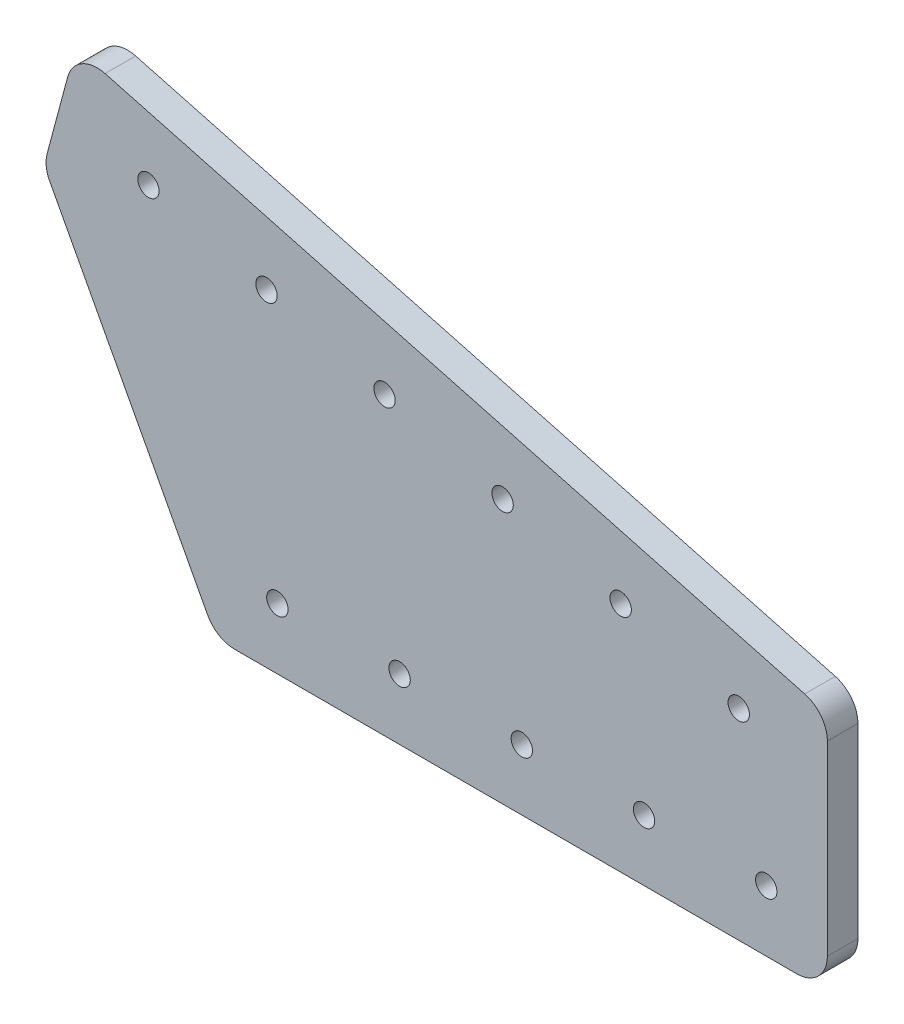
from build123d import *

# Parameters (mm, degrees)
BOSS_EXTRU_1_DEPTH           = 10
CONG_1_R                     = 10
ENL_V_MAT_EXTRU_1_DEPTH      = 246.669614874
ENL_V_MAT_EXTRU_1_DEPTH_BACK = 246.669614874
ESQUISSE2_R                  = 3.5


with BuildPart() as part:
    # Esquisse1 → Boss.-Extru.1 (new body)
    with BuildSketch(Plane.XY):
        Polygon((0, 0), (-56.389768432, 105.925417234), (-46.037006628, 144.562450286), (200, 78.637033052), (200, 0), align=None)
    extrude(amount=BOSS_EXTRU_1_DEPTH)

    # Congé1
    cong_1_edges = [part.edges().sort_by_distance(p)[0] for p in [
        (0, 0, 5),
        (-56.389768432, 105.925417234, 5),
        (-46.037006628, 144.562450286, 5),
        (200, 78.637033052, 5),
        (200, 0, 5),
    ]]
    fillet(cong_1_edges, radius=CONG_1_R)

    # Esquisse2 → Enlèv. mat.-Extru.1 (cut, two sides: drawn at the far end of the back side and taken through both)
    with BuildSketch(Plane.XY.offset(10).offset(-ENL_V_MAT_EXTRU_1_DEPTH_BACK)):
        with Locations((-22.199276394, 117.469626112)):
            Circle(ESQUISSE2_R)
        with Locations((16.437756658, 107.116864308)):
            Circle(ESQUISSE2_R)
        with Locations((55.074789709, 96.764102504)):
            Circle(ESQUISSE2_R)
        with Locations((93.711822761, 86.4113407)):
            Circle(ESQUISSE2_R)
        with Locations((132.348855812, 76.058578895)):
            Circle(ESQUISSE2_R)
        with Locations((170.985888864, 65.705817091)):
            Circle(ESQUISSE2_R)
        with Locations((20, 20)):
            Circle(ESQUISSE2_R)
        with Locations((60, 20)):
            Circle(ESQUISSE2_R)
        with Locations((100, 20)):
            Circle(ESQUISSE2_R)
        with Locations((180, 20)):
            Circle(ESQUISSE2_R)
        with Locations((140, 20)):
            Circle(ESQUISSE2_R)
    extrude(amount=ENL_V_MAT_EXTRU_1_DEPTH + ENL_V_MAT_EXTRU_1_DEPTH_BACK, mode=Mode.SUBTRACT)


solid = part.part
